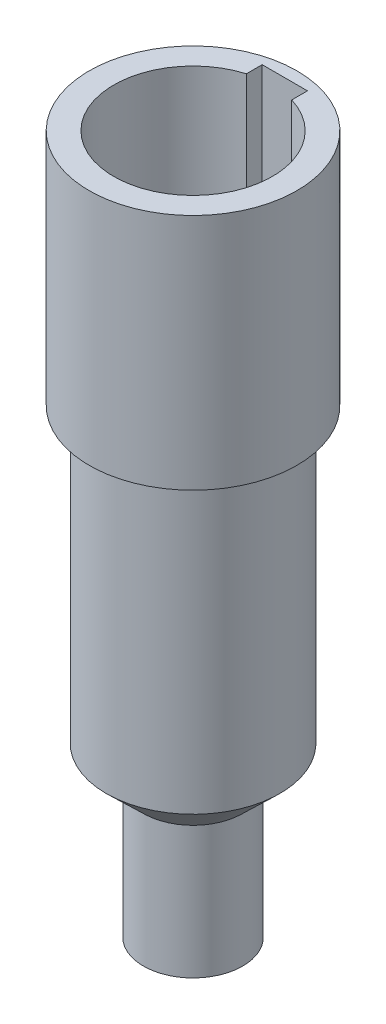
from build123d import *

# Parameters (mm, degrees)
SKETCH2_R          = 21
CUT_EXTRUDE1_DEPTH = 57
SKETCH3_W          = 12
SKETCH3_H          = 8.3
CUT_EXTRUDE2_DEPTH = 57


with BuildPart() as part:
    # Sketch1 → Revolve1 (revolve)
    with BuildSketch(Plane.XY, mode=Mode.PRIVATE) as revolve1_sk:
        Polygon((0, 0), (-13.15, 0), (-13.15, 35), (-23, 44.5), (-23, 122), (-27.5, 122), (-27.5, 185), (-11, 185), (-11, 145), (0, 145), align=None)
    revolve(revolve1_sk.sketch.rotate(Axis((0, 0, 0), (0, 1, 0)), 270), axis=Axis((0, 0, 0), (0, 1, 0)))

    # Sketch2 → Cut-Extrude1 (cut)
    with BuildSketch(Plane(origin=(0, 185, 0), x_dir=(1, 0, 0), z_dir=(0, 1, 0))):
        with Locations(Location((0, 0, 0), (0, 0, 270))):
            Circle(SKETCH2_R)
    extrude(amount=-CUT_EXTRUDE1_DEPTH, mode=Mode.SUBTRACT)

    # Sketch3 → Cut-Extrude2 (cut)
    with BuildSketch(Plane(origin=(0, 185, 0), x_dir=(1, 0, 0), z_dir=(0, 1, 0))):
        with Locations((0, 20.15)):
            Rectangle(SKETCH3_W, SKETCH3_H)
    extrude(amount=-CUT_EXTRUDE2_DEPTH, mode=Mode.SUBTRACT)


solid = part.part
